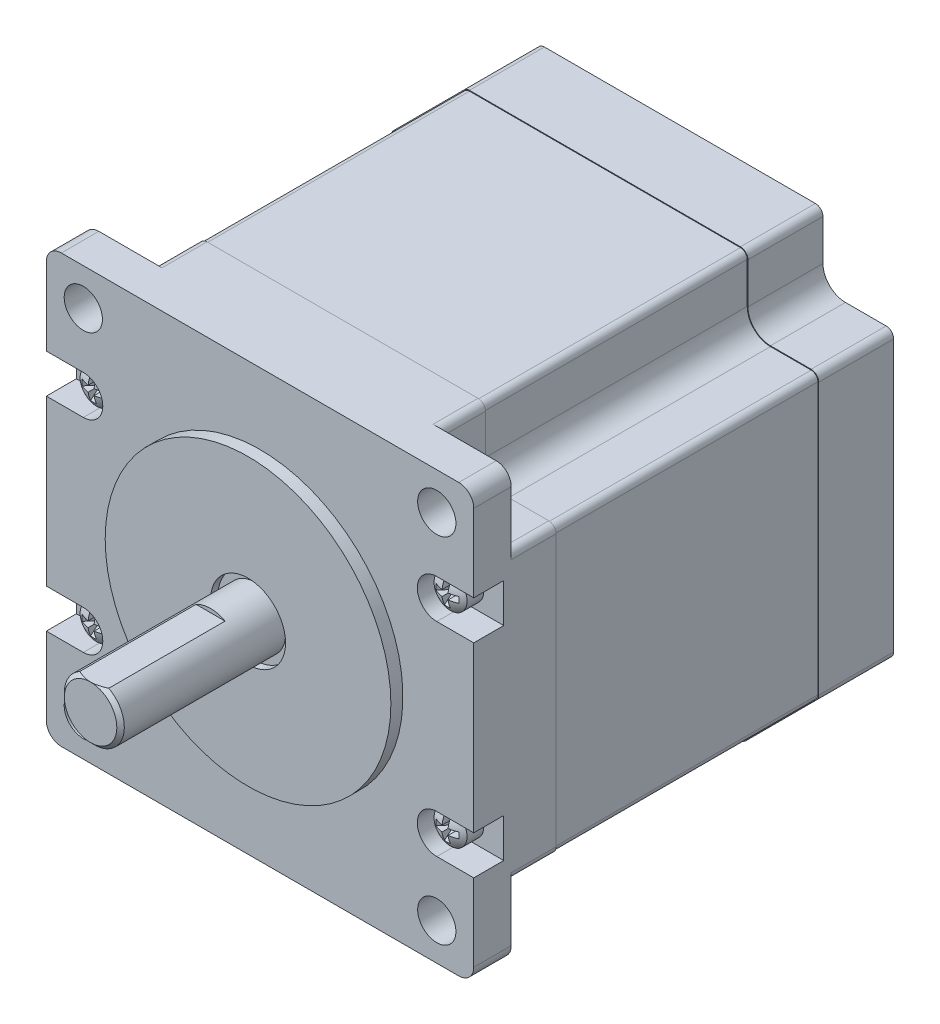
from build123d import *

# Parameters (mm, degrees)
RESSALTO_EXTRUS_O1_DEPTH    = 5
ESBO_O2_R                   = 2.55
CORTE_EXTRUS_O1_DEPTH       = 41.614036982
RESSALTO_EXTRUS_O2_DEPTH    = 6
CORTE_EXTRUS_O2_DEPTH       = 4
CORTE_EXTRUS_O3_DEPTH       = 0.4
PADR_OCIRCULAR1_COUNT       = 2
PADR_OCIRCULAR1_ANGLE       = 90
PADR_O_LINEAR1_COUNT        = 2
PADR_O_LINEAR1_PITCH        = 27.2
PADR_O_LINEAR1_COUNT_DIR2   = 2
PADR_O_LINEAR1_PITCH_DIR2   = 47.2
PADR_O_LINEAR1_COPY_1_DEPTH = 0.4
PADR_O_LINEAR1_COPY_2_DEPTH = 0.4
PADR_O_LINEAR1_COPY_3_DEPTH = 0.4
RESSALTO_EXTRUS_O3_DEPTH    = 35
RESSALTO_EXTRUS_O4_DEPTH    = 10
ESBO_O10_R                  = 19.05
RESSALTO_EXTRUS_O5_DEPTH    = 1.6
ESBO_O11_R                  = 5
CORTE_EXTRUS_O4_DEPTH       = 1
ESBO_O12_R                  = 4
RESSALTO_EXTRUS_O6_DEPTH    = 22
CHANFRO1_SIZE               = 0.5
CORTE_EXTRUS_O5_START       = -16
CORTE_EXTRUS_O5_DEPTH       = 16
ESBO_O14_R                  = 5
ESBO_O14_R_2                = 4
CORTE_EXTRUS_O6_DEPTH       = 1.5


with BuildPart() as part:
    # Esboço1 → Ressalto-extrusão1 (new body)
    with BuildSketch(Plane.XY):
        with BuildLine():
            Line((-26.5, -28.5), (26.5, -28.5))
            ThreePointArc((26.5, -28.5), (27.914213562, -27.914213562), (28.5, -26.5))
            Line((28.5, -26.5), (28.5, 26.5))
            ThreePointArc((28.5, 26.5), (27.914213562, 27.914213562), (26.5, 28.5))
            Line((26.5, 28.5), (-26.5, 28.5))
            ThreePointArc((-26.5, 28.5), (-27.914213562, 27.914213562), (-28.5, 26.5))
            Line((-28.5, 26.5), (-28.5, -26.5))
            ThreePointArc((-28.5, -26.5), (-27.914213562, -27.914213562), (-26.5, -28.5))
        make_face()
    extrude(amount=RESSALTO_EXTRUS_O1_DEPTH)

    # Esboço2 → Corte-extrusão1 (cut, through all)
    with BuildSketch(Plane.XY.offset(5)):
        with Locations((-23.57, -23.57)):
            Circle(ESBO_O2_R)
        with Locations((-23.57, 23.57)):
            Circle(ESBO_O2_R)
        with Locations((23.57, 23.57)):
            Circle(ESBO_O2_R)
        with Locations((23.57, -23.57)):
            Circle(ESBO_O2_R)
    extrude(amount=-CORTE_EXTRUS_O1_DEPTH, mode=Mode.SUBTRACT)

    # Esboço4 → Ressalto-extrusão2 (add)
    with BuildSketch(Plane(origin=(0, 0, 0), x_dir=(-1, 0, 0), z_dir=(0, 0, -1))):
        with BuildLine():
            Line((-28.5, 18.07), (-28.5, -18.07))
            ThreePointArc((-28.5, -18.07), (-28.207106781, -18.777106781), (-27.5, -19.07))
            Line((-27.5, -19.07), (-22.07, -19.07))
            ThreePointArc((-22.07, -19.07), (-19.948679656, -19.948679656), (-19.07, -22.07))
            Line((-19.07, -22.07), (-19.07, -27.5))
            ThreePointArc((-19.07, -27.5), (-18.777106781, -28.207106781), (-18.07, -28.5))
            Line((-18.07, -28.5), (18.07, -28.5))
            ThreePointArc((18.07, -28.5), (18.777106781, -28.207106781), (19.07, -27.5))
            Line((19.07, -27.5), (19.07, -22.07))
            ThreePointArc((19.07, -22.07), (19.948679656, -19.948679656), (22.07, -19.07))
            Line((22.07, -19.07), (27.5, -19.07))
            ThreePointArc((27.5, -19.07), (28.207106781, -18.777106781), (28.5, -18.07))
            Line((28.5, -18.07), (28.5, 18.07))
            ThreePointArc((28.5, 18.07), (28.207106781, 18.777106781), (27.5, 19.07))
            Line((27.5, 19.07), (22.07, 19.07))
            ThreePointArc((22.07, 19.07), (19.948679656, 19.948679656), (19.07, 22.07))
            Line((19.07, 22.07), (19.07, 27.5))
            ThreePointArc((19.07, 27.5), (18.777106781, 28.207106781), (18.07, 28.5))
            Line((18.07, 28.5), (-18.07, 28.5))
            ThreePointArc((-18.07, 28.5), (-18.777106781, 28.207106781), (-19.07, 27.5))
            Line((-19.07, 27.5), (-19.07, 22.07))
            ThreePointArc((-19.07, 22.07), (-19.948679656, 19.948679656), (-22.07, 19.07))
            Line((-22.07, 19.07), (-27.5, 19.07))
            ThreePointArc((-27.5, 19.07), (-28.207106781, 18.777106781), (-28.5, 18.07))
        make_face()
    extrude(amount=RESSALTO_EXTRUS_O2_DEPTH)

    # Esboço5 → Corte-extrusão2 (cut)
    with BuildSketch(Plane.XY.offset(5)):
        with BuildLine():
            Line((-28.5, -10.97), (-23.57, -10.97))
            ThreePointArc((-23.57, -10.97), (-20.97, -13.57), (-23.57, -16.17))
            Line((-23.57, -16.17), (-28.5, -16.17))
            Line((-28.5, -16.17), (-28.5, -10.97))
        make_face()
        with BuildLine():
            Line((-28.5, 16.17), (-28.5, 10.97))
            Line((-28.5, 10.97), (-23.57, 10.97))
            ThreePointArc((-23.57, 10.97), (-20.97, 13.57), (-23.57, 16.17))
            Line((-23.57, 16.17), (-28.5, 16.17))
        make_face()
        with BuildLine():
            Line((28.5, 10.97), (23.57, 10.97))
            ThreePointArc((23.57, 10.97), (20.97, 13.57), (23.57, 16.17))
            Line((23.57, 16.17), (28.5, 16.17))
            Line((28.5, 16.17), (28.5, 10.97))
        make_face()
        with BuildLine():
            Line((28.5, -16.17), (28.5, -10.97))
            Line((28.5, -10.97), (23.57, -10.97))
            ThreePointArc((23.57, -10.97), (20.97, -13.57), (23.57, -16.17))
            Line((23.57, -16.17), (28.5, -16.17))
        make_face()
    extrude(amount=-CORTE_EXTRUS_O2_DEPTH, mode=Mode.SUBTRACT)

    # Esboço6 → Revolução1 (revolve)
    with BuildSketch(Plane(origin=(-23.57, 0, 0), x_dir=(0, 0, -1), z_dir=(1, 0, 0))):
        with BuildLine():
            Line((-1, 15.77), (-3.222131518, 15.77))
            ThreePointArc((-3.222131518, 15.77), (-3.799807594, 14.736734693), (-4, 13.57))
            Line((-4, 13.57), (-1, 13.57))
            Line((-1, 13.57), (-1, 15.77))
        make_face()
    revolu_o1 = revolve(axis=Axis((-23.57, 13.57, 1), (0, 0, 1)))

    # Esboço7 → Corte-extrusão3 (cut, symmetric)
    with BuildSketch(Plane(origin=(-23.57, 0, 0), x_dir=(0, 0, -1), z_dir=(1, 0, 0))):
        with BuildLine():
            Line((-3.646856153, 15.102088886), (-2.2, 13.888032422))
            Line((-2.2, 13.888032422), (-2.2, 13.251967578))
            Line((-2.2, 13.251967578), (-3.646856153, 12.037911114))
            ThreePointArc((-3.646856153, 12.037911114), (-6.932431372, 13.57), (-3.646856153, 15.102088886))
        make_face()
    corte_extrus_o3 = extrude(amount=CORTE_EXTRUS_O3_DEPTH, both=True, mode=Mode.SUBTRACT)

    # PadrãoCircular1: Corte-extrusão3 ×2 about axis
    padr_ocircular1_axis = Axis((-23.57, 13.57, 1), (0, 0, -1))
    for i in range(1, PADR_OCIRCULAR1_COUNT):
        add(corte_extrus_o3.rotate(padr_ocircular1_axis, i * PADR_OCIRCULAR1_ANGLE / (PADR_OCIRCULAR1_COUNT - 1)), mode=Mode.SUBTRACT)

    # Padrão linear1: Revolução1, Corte-extrus_o3 2 × 2
    with Locations(*[(j * PADR_O_LINEAR1_PITCH_DIR2, -i * PADR_O_LINEAR1_PITCH, 0) for i in range(PADR_O_LINEAR1_COUNT) for j in range(PADR_O_LINEAR1_COUNT_DIR2) if (i, j) != (0, 0)]):
        add(revolu_o1)
        add(corte_extrus_o3, mode=Mode.SUBTRACT)

    # Padrão linear1 copy 1 sketch → Padrão linear1 copy 1 (cut, symmetric)
    with BuildSketch(Plane(origin=(10.06, 13.57, 0), x_dir=(0, 0, -1), z_dir=(0, -1, 0))):
        with BuildLine():
            Line((-3.646856153, 15.102088886), (-2.2, 13.888032422))
            Line((-2.2, 13.888032422), (-2.2, 13.251967578))
            Line((-2.2, 13.251967578), (-3.646856153, 12.037911114))
            ThreePointArc((-3.646856153, 12.037911114), (-6.932431372, 13.57), (-3.646856153, 15.102088886))
        make_face()
    extrude(amount=PADR_O_LINEAR1_COPY_1_DEPTH, both=True, mode=Mode.SUBTRACT)

    # Padrão linear1 copy 2 sketch → Padrão linear1 copy 2 (cut, symmetric)
    with BuildSketch(Plane(origin=(-37.14, -13.63, 0), x_dir=(0, 0, -1), z_dir=(0, -1, 0))):
        with BuildLine():
            Line((-3.646856153, 15.102088886), (-2.2, 13.888032422))
            Line((-2.2, 13.888032422), (-2.2, 13.251967578))
            Line((-2.2, 13.251967578), (-3.646856153, 12.037911114))
            ThreePointArc((-3.646856153, 12.037911114), (-6.932431372, 13.57), (-3.646856153, 15.102088886))
        make_face()
    extrude(amount=PADR_O_LINEAR1_COPY_2_DEPTH, both=True, mode=Mode.SUBTRACT)

    # Padrão linear1 copy 3 sketch → Padrão linear1 copy 3 (cut, symmetric)
    with BuildSketch(Plane(origin=(10.06, -13.63, 0), x_dir=(0, 0, -1), z_dir=(0, -1, 0))):
        with BuildLine():
            Line((-3.646856153, 15.102088886), (-2.2, 13.888032422))
            Line((-2.2, 13.888032422), (-2.2, 13.251967578))
            Line((-2.2, 13.251967578), (-3.646856153, 12.037911114))
            ThreePointArc((-3.646856153, 12.037911114), (-6.932431372, 13.57), (-3.646856153, 15.102088886))
        make_face()
    extrude(amount=PADR_O_LINEAR1_COPY_3_DEPTH, both=True, mode=Mode.SUBTRACT)

    # Esboço8 → Ressalto-extrusão3 (add)
    with BuildSketch(Plane(origin=(0, 0, -6), x_dir=(-1, 0, 0), z_dir=(0, 0, -1))):
        with BuildLine():
            Line((-27.5, -18.97), (-22.07, -18.97))
            ThreePointArc((-22.07, -18.97), (-19.877968978, -19.877968978), (-18.97, -22.07))
            Line((-18.97, -22.07), (-18.97, -27.5))
            ThreePointArc((-18.97, -27.5), (-18.706396103, -28.136396103), (-18.07, -28.4))
            Line((-18.07, -28.4), (18.07, -28.4))
            ThreePointArc((18.07, -28.4), (18.706396103, -28.136396103), (18.97, -27.5))
            Line((18.97, -27.5), (18.97, -22.07))
            ThreePointArc((18.97, -22.07), (19.877968978, -19.877968978), (22.07, -18.97))
            Line((22.07, -18.97), (27.5, -18.97))
            ThreePointArc((27.5, -18.97), (28.136396103, -18.706396103), (28.4, -18.07))
            Line((28.4, -18.07), (28.4, 18.07))
            ThreePointArc((28.4, 18.07), (28.136396103, 18.706396103), (27.5, 18.97))
            Line((27.5, 18.97), (22.07, 18.97))
            ThreePointArc((22.07, 18.97), (19.877968978, 19.877968978), (18.97, 22.07))
            Line((18.97, 22.07), (18.97, 27.5))
            ThreePointArc((18.97, 27.5), (18.706396103, 28.136396103), (18.07, 28.4))
            Line((18.07, 28.4), (-18.07, 28.4))
            ThreePointArc((-18.07, 28.4), (-18.706396103, 28.136396103), (-18.97, 27.5))
            Line((-18.97, 27.5), (-18.97, 22.07))
            ThreePointArc((-18.97, 22.07), (-19.877968978, 19.877968978), (-22.07, 18.97))
            Line((-22.07, 18.97), (-27.5, 18.97))
            ThreePointArc((-27.5, 18.97), (-28.136396103, 18.706396103), (-28.4, 18.07))
            Line((-28.4, 18.07), (-28.4, -18.07))
            ThreePointArc((-28.4, -18.07), (-28.136396103, -18.706396103), (-27.5, -18.97))
        make_face()
    extrude(amount=RESSALTO_EXTRUS_O3_DEPTH)

    # Esboço9 → Ressalto-extrusão4 (add)
    with BuildSketch(Plane(origin=(0, 0, -41), x_dir=(-1, 0, 0), z_dir=(0, 0, -1))):
        with BuildLine():
            Line((-27.5, -19.07), (-22.07, -19.07))
            ThreePointArc((-22.07, -19.07), (-19.948679656, -19.948679656), (-19.07, -22.07))
            Line((-19.07, -22.07), (-19.07, -27.5))
            ThreePointArc((-19.07, -27.5), (-18.777106781, -28.207106781), (-18.07, -28.5))
            Line((-18.07, -28.5), (18.07, -28.5))
            ThreePointArc((18.07, -28.5), (18.777106781, -28.207106781), (19.07, -27.5))
            Line((19.07, -27.5), (19.07, -22.07))
            ThreePointArc((19.07, -22.07), (19.948679656, -19.948679656), (22.07, -19.07))
            Line((22.07, -19.07), (27.5, -19.07))
            ThreePointArc((27.5, -19.07), (28.207106781, -18.777106781), (28.5, -18.07))
            Line((28.5, -18.07), (28.5, 18.07))
            ThreePointArc((28.5, 18.07), (28.207106781, 18.777106781), (27.5, 19.07))
            Line((27.5, 19.07), (22.07, 19.07))
            ThreePointArc((22.07, 19.07), (19.948679656, 19.948679656), (19.07, 22.07))
            Line((19.07, 22.07), (19.07, 27.5))
            ThreePointArc((19.07, 27.5), (18.777106781, 28.207106781), (18.07, 28.5))
            Line((18.07, 28.5), (-18.07, 28.5))
            ThreePointArc((-18.07, 28.5), (-18.777106781, 28.207106781), (-19.07, 27.5))
            Line((-19.07, 27.5), (-19.07, 22.07))
            ThreePointArc((-19.07, 22.07), (-19.948679656, 19.948679656), (-22.07, 19.07))
            Line((-22.07, 19.07), (-27.5, 19.07))
            ThreePointArc((-27.5, 19.07), (-28.207106781, 18.777106781), (-28.5, 18.07))
            Line((-28.5, 18.07), (-28.5, -18.07))
            ThreePointArc((-28.5, -18.07), (-28.207106781, -18.777106781), (-27.5, -19.07))
        make_face()
    extrude(amount=RESSALTO_EXTRUS_O4_DEPTH)

    # Esboço10 → Ressalto-extrusão5 (add)
    with BuildSketch(Plane.XY.offset(5)):
        Circle(ESBO_O10_R)
    extrude(amount=RESSALTO_EXTRUS_O5_DEPTH)

    # Esboço11 → Corte-extrusão4 (cut)
    with BuildSketch(Plane.XY.offset(6.6)):
        Circle(ESBO_O11_R)
    extrude(amount=-CORTE_EXTRUS_O4_DEPTH, mode=Mode.SUBTRACT)

    # Esboço12 → Ressalto-extrusão6 (add)
    with BuildSketch(Plane.XY.offset(5.6)):
        Circle(ESBO_O12_R)
    extrude(amount=RESSALTO_EXTRUS_O6_DEPTH)

    # Chanfro1
    chanfro1_edges = [part.edges().sort_by_distance(p)[0] for p in [
        (-4, 0, 27.6),
    ]]
    chamfer(chanfro1_edges, length=CHANFRO1_SIZE)

    # Esboço13 → Corte-extrusão5 (cut)
    with BuildSketch(Plane.XY.offset(27.6).offset(CORTE_EXTRUS_O5_START)):
        with BuildLine():
            Line((-1.936491673, 3.5), (1.936491673, 3.5))
            ThreePointArc((1.936491673, 3.5), (0, 4), (-1.936491673, 3.5))
        make_face()
    extrude(amount=CORTE_EXTRUS_O5_DEPTH, mode=Mode.SUBTRACT)

    # Esboço14 → Corte-extrusão6 (cut)
    with BuildSketch(Plane(origin=(0, 0, -51), x_dir=(-1, 0, 0), z_dir=(0, 0, -1))):
        Circle(ESBO_O14_R)
        Circle(ESBO_O14_R_2, mode=Mode.SUBTRACT)
    extrude(amount=-CORTE_EXTRUS_O6_DEPTH, mode=Mode.SUBTRACT)


solid = part.part
